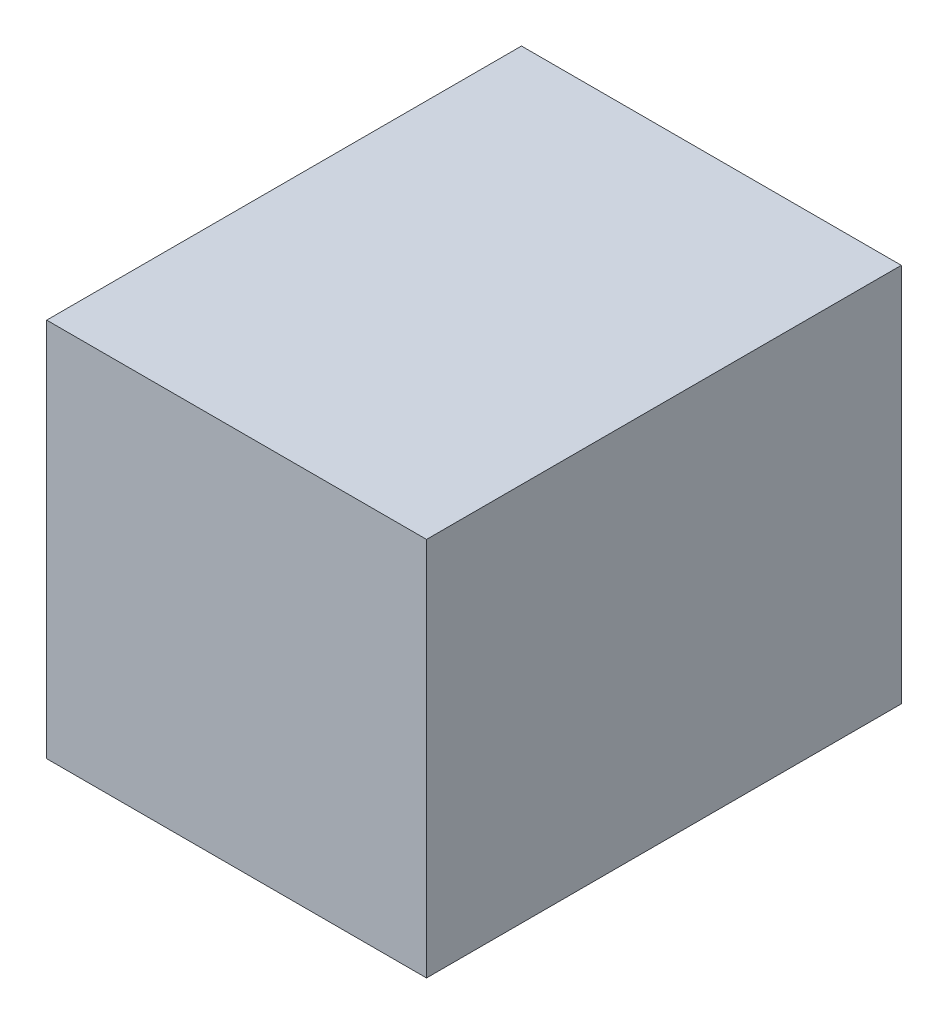
from build123d import *

# Parameters (mm, degrees)
SKETCH1_W           = 20
SKETCH1_H           = 25
BOSS_EXTRUDE1_DEPTH = 20


with BuildPart() as part:
    # Sketch1 → Boss-Extrude1 (new body)
    with BuildSketch(Plane(origin=(0, 0, 0), x_dir=(1, 0, 0), z_dir=(0, 1, 0))):
        Rectangle(SKETCH1_W, SKETCH1_H)
    extrude(amount=BOSS_EXTRUDE1_DEPTH)


solid = part.part
